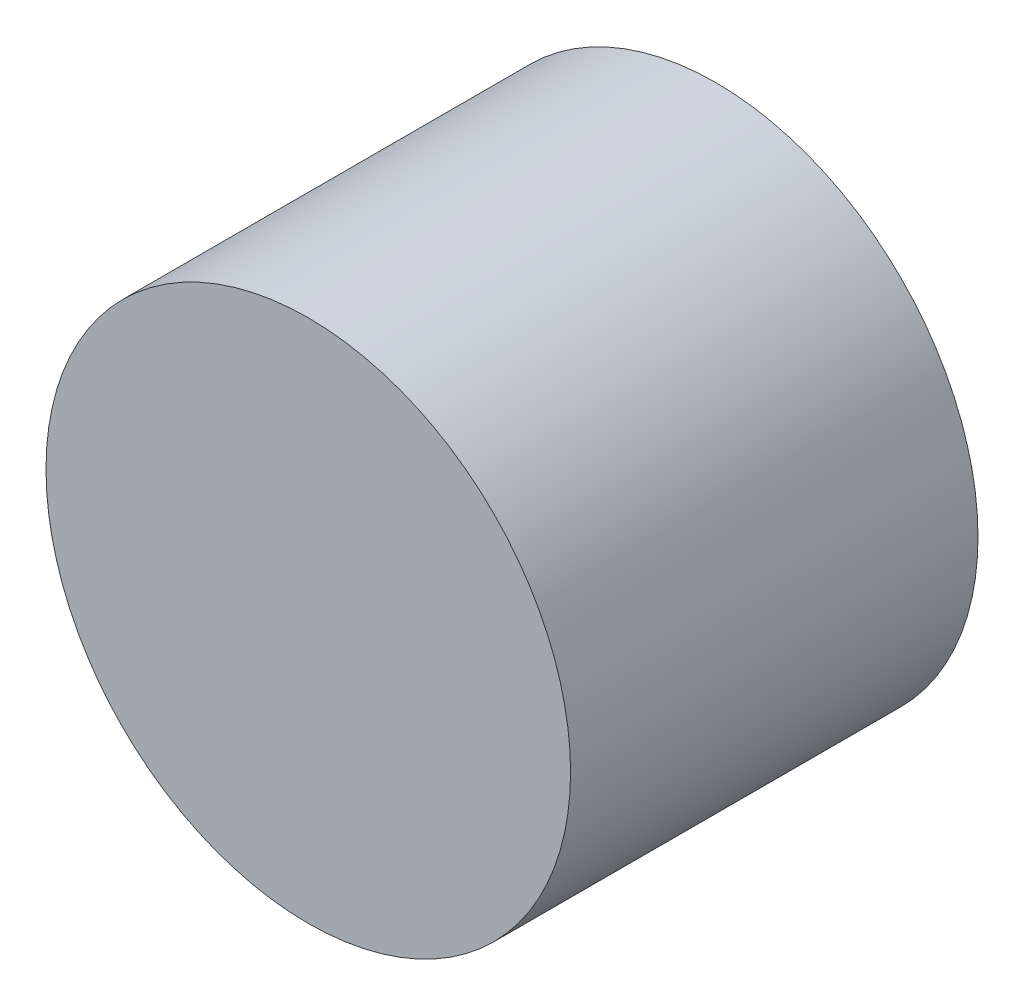
from build123d import *

# Parameters (mm, degrees)
SKETCH1_R           = 11.475
BOSS_EXTRUDE1_DEPTH = 17.825


with BuildPart() as part:
    # Sketch1 → Boss-Extrude1 (new body)
    with BuildSketch(Plane.XY):
        with Locations((7.125, -5.675)):
            Circle(SKETCH1_R)
    extrude(amount=BOSS_EXTRUDE1_DEPTH)


solid = part.part
